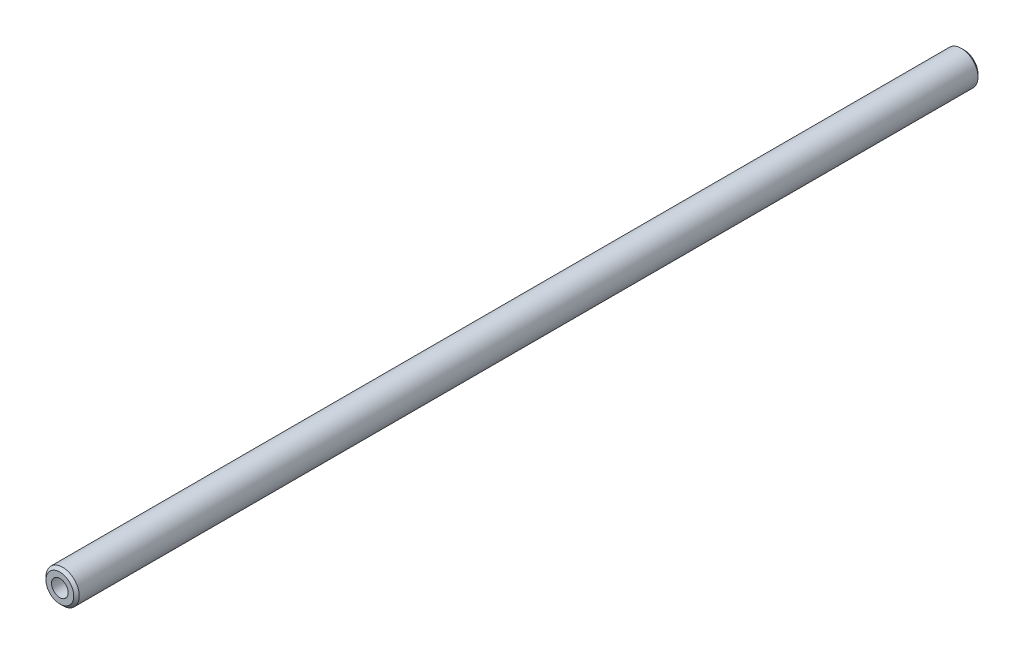
from build123d import *

# Parameters (mm, degrees)
SKETCH_1_R      = 6
SKETCH_1_R_2    = 3
EXTRUDE_1_DEPTH = 326
CHAMFER_1_SIZE  = 1


with BuildPart() as part:
    # 草图1 → 凸台-拉伸1 (new body)
    with BuildSketch(Plane.XY):
        Circle(SKETCH_1_R)
        Circle(SKETCH_1_R_2, mode=Mode.SUBTRACT)
    extrude(amount=EXTRUDE_1_DEPTH)

    # 倒角1
    chamfer_1_edges = [part.edges().sort_by_distance(p)[0] for p in [
        (-6, 0, 0),
        (-6, 0, 326),
    ]]
    chamfer(chamfer_1_edges, length=CHAMFER_1_SIZE)


solid = part.part
